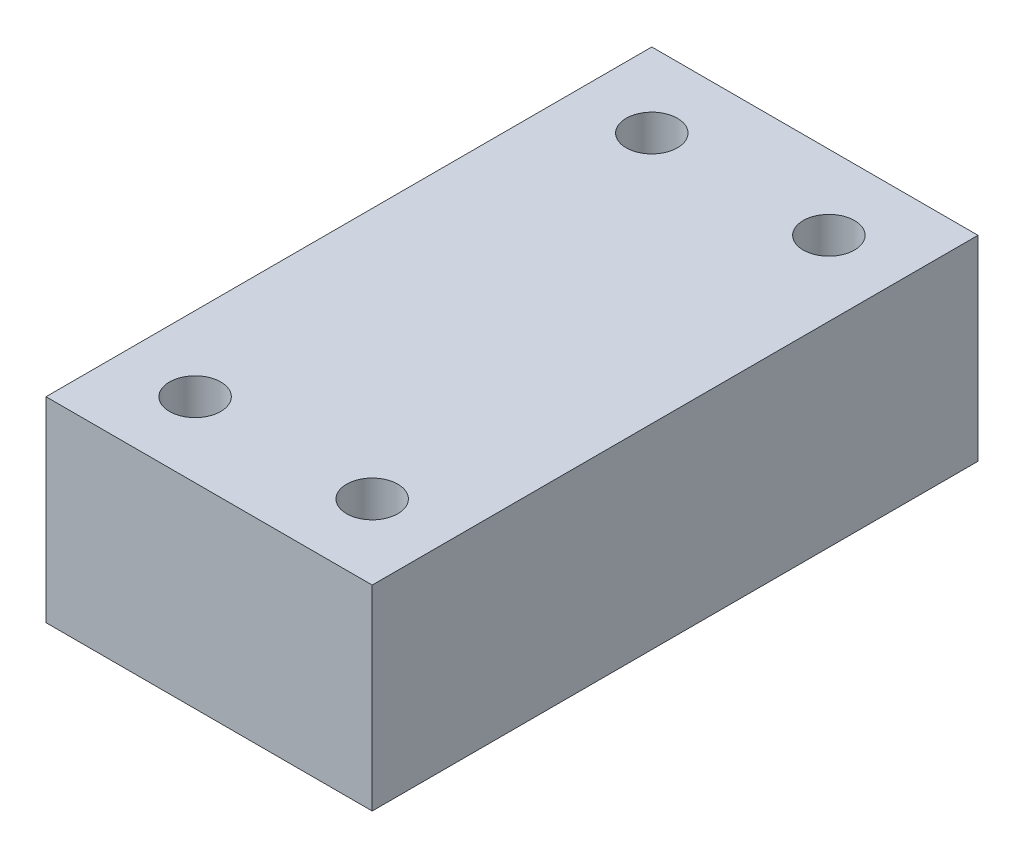
from build123d import *

# Parameters (mm, degrees)
SKIZZE1_W                       = 35
SKIZZE1_H                       = 65
AUFSATZ_LINEAR_AUSTRAGEN1_DEPTH = 21
DURCHGANGSLOCH_F_R_M51_D        = 5.5


with BuildPart() as part:
    # Skizze1 → Aufsatz-Linear austragen1 (new body)
    with BuildSketch(Plane(origin=(0, 0, 0), x_dir=(1, 0, 0), z_dir=(0, 1, 0))):
        Rectangle(SKIZZE1_W, SKIZZE1_H)
    extrude(amount=AUFSATZ_LINEAR_AUSTRAGEN1_DEPTH)

    # Durchgangsloch für M51 (through all)
    with Locations(Plane(origin=(78.125902763, 21, -61.744554923), x_dir=(1, 0, 0), z_dir=(0, 1, 0))):
        with Locations((-68.625902763, -37.244554923), (-87.625902763, -37.244554923), (-87.625902763, -86.244554923), (-68.625902763, -86.244554923)):
            Hole(DURCHGANGSLOCH_F_R_M51_D / 2)


solid = part.part
